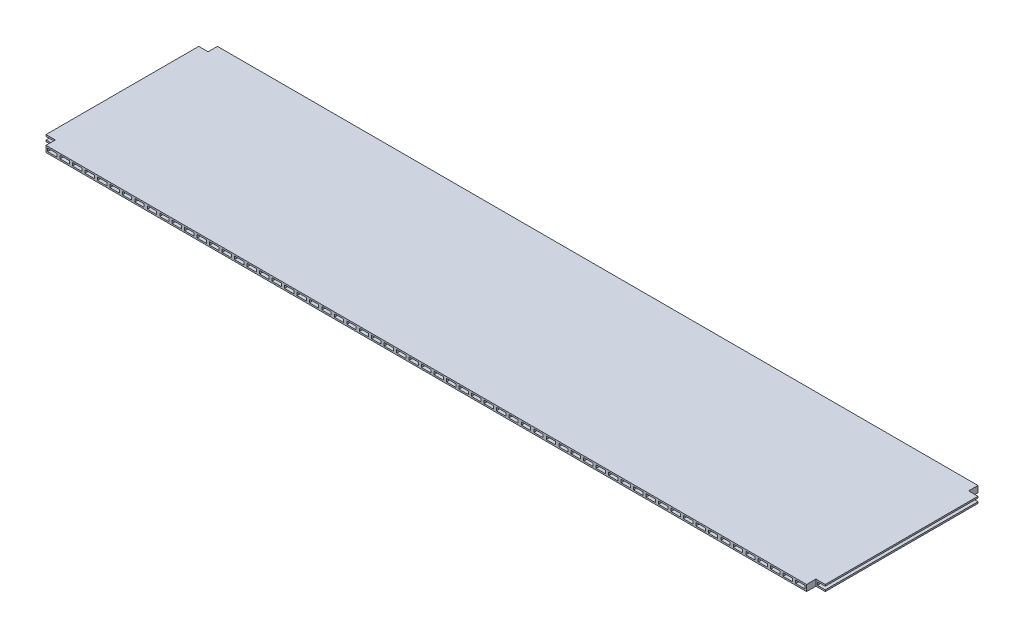
from build123d import *

# Parameters (mm, degrees)
SKETCH_1_W               = 500
SKETCH_1_H               = 110
EXTRUDE_1_DEPTH          = 4
CUT_EXTRUDE_1_DEPTH      = 274.159294186
CUT_EXTRUDE_1_DEPTH_BACK = 274.159294186
SKETCH_2_W               = 6
SKETCH_2_H               = 2
CUT_EXTRUDE_2_DEPTH      = 274.159294186
CUT_EXTRUDE_2_DEPTH_BACK = 274.159294186
SKETCH_3_W               = 6
SKETCH_3_H               = 6


with BuildPart() as part:
    # 草图1 → 凸台-拉伸1 (new body)
    with BuildSketch(Plane(origin=(0, 0, 0), x_dir=(1, 0, 0), z_dir=(0, 1, 0))):
        with Locations((0, 55)):
            Rectangle(SKETCH_1_W, SKETCH_1_H)
    extrude(amount=EXTRUDE_1_DEPTH)

    # 草图2 → 切除-拉伸1 (cut, two sides: drawn at the far end of the back side and taken through both)
    with BuildSketch(Plane(origin=(0, 0, -110), x_dir=(-1, 0, 0), z_dir=(0, 0, -1)).offset(-CUT_EXTRUDE_1_DEPTH_BACK)):
        with Locations((-56, 2)):
            Rectangle(SKETCH_2_W, SKETCH_2_H)
        with Locations((0, 2)):
            Rectangle(SKETCH_2_W, SKETCH_2_H)
        with Locations((8, 2)):
            Rectangle(SKETCH_2_W, SKETCH_2_H)
        with Locations((16, 2)):
            Rectangle(SKETCH_2_W, SKETCH_2_H)
        with Locations((24, 2)):
            Rectangle(SKETCH_2_W, SKETCH_2_H)
        with Locations((32, 2)):
            Rectangle(SKETCH_2_W, SKETCH_2_H)
        with Locations((40, 2)):
            Rectangle(SKETCH_2_W, SKETCH_2_H)
        with Locations((48, 2)):
            Rectangle(SKETCH_2_W, SKETCH_2_H)
        with Locations((-8, 2)):
            Rectangle(SKETCH_2_W, SKETCH_2_H)
        with Locations((-16, 2)):
            Rectangle(SKETCH_2_W, SKETCH_2_H)
        with Locations((-24, 2)):
            Rectangle(SKETCH_2_W, SKETCH_2_H)
        with Locations((-32, 2)):
            Rectangle(SKETCH_2_W, SKETCH_2_H)
        with Locations((-40, 2)):
            Rectangle(SKETCH_2_W, SKETCH_2_H)
        with Locations((-48, 2)):
            Rectangle(SKETCH_2_W, SKETCH_2_H)
        with Locations((-64, 2)):
            Rectangle(SKETCH_2_W, SKETCH_2_H)
        with Locations((-72, 2)):
            Rectangle(SKETCH_2_W, SKETCH_2_H)
        with Locations((-80, 2)):
            Rectangle(SKETCH_2_W, SKETCH_2_H)
        with Locations((-88, 2)):
            Rectangle(SKETCH_2_W, SKETCH_2_H)
        with Locations((-96, 2)):
            Rectangle(SKETCH_2_W, SKETCH_2_H)
        with Locations((-104, 2)):
            Rectangle(SKETCH_2_W, SKETCH_2_H)
        with Locations((-112, 2)):
            Rectangle(SKETCH_2_W, SKETCH_2_H)
        with Locations((-120, 2)):
            Rectangle(SKETCH_2_W, SKETCH_2_H)
        with Locations((-128, 2)):
            Rectangle(SKETCH_2_W, SKETCH_2_H)
        with Locations((-136, 2)):
            Rectangle(SKETCH_2_W, SKETCH_2_H)
        with Locations((-144, 2)):
            Rectangle(SKETCH_2_W, SKETCH_2_H)
        with Locations((-152, 2)):
            Rectangle(SKETCH_2_W, SKETCH_2_H)
        with Locations((-160, 2)):
            Rectangle(SKETCH_2_W, SKETCH_2_H)
        with Locations((-168, 2)):
            Rectangle(SKETCH_2_W, SKETCH_2_H)
        with Locations((-176, 2)):
            Rectangle(SKETCH_2_W, SKETCH_2_H)
        with Locations((-184, 2)):
            Rectangle(SKETCH_2_W, SKETCH_2_H)
        with Locations((-192, 2)):
            Rectangle(SKETCH_2_W, SKETCH_2_H)
        with Locations((-200, 2)):
            Rectangle(SKETCH_2_W, SKETCH_2_H)
        with Locations((-208, 2)):
            Rectangle(SKETCH_2_W, SKETCH_2_H)
        with Locations((-216, 2)):
            Rectangle(SKETCH_2_W, SKETCH_2_H)
        with Locations((-224, 2)):
            Rectangle(SKETCH_2_W, SKETCH_2_H)
        with Locations((-232, 2)):
            Rectangle(SKETCH_2_W, SKETCH_2_H)
        with Locations((-240, 2)):
            Rectangle(SKETCH_2_W, SKETCH_2_H)
        with Locations((-248, 2)):
            Rectangle(SKETCH_2_W, SKETCH_2_H)
        with Locations((-256, 2)):
            Rectangle(SKETCH_2_W, SKETCH_2_H)
        with Locations((-264, 2)):
            Rectangle(SKETCH_2_W, SKETCH_2_H)
        with Locations((-272, 2)):
            Rectangle(SKETCH_2_W, SKETCH_2_H)
        with Locations((-280, 2)):
            Rectangle(SKETCH_2_W, SKETCH_2_H)
        with Locations((-288, 2)):
            Rectangle(SKETCH_2_W, SKETCH_2_H)
        with Locations((-296, 2)):
            Rectangle(SKETCH_2_W, SKETCH_2_H)
        with Locations((-304, 2)):
            Rectangle(SKETCH_2_W, SKETCH_2_H)
        with Locations((-312, 2)):
            Rectangle(SKETCH_2_W, SKETCH_2_H)
        with Locations((56, 2)):
            Rectangle(SKETCH_2_W, SKETCH_2_H)
        with Locations((64, 2)):
            Rectangle(SKETCH_2_W, SKETCH_2_H)
        with Locations((72, 2)):
            Rectangle(SKETCH_2_W, SKETCH_2_H)
        with Locations((80, 2)):
            Rectangle(SKETCH_2_W, SKETCH_2_H)
        with Locations((88, 2)):
            Rectangle(SKETCH_2_W, SKETCH_2_H)
        with Locations((96, 2)):
            Rectangle(SKETCH_2_W, SKETCH_2_H)
        with Locations((104, 2)):
            Rectangle(SKETCH_2_W, SKETCH_2_H)
        with Locations((112, 2)):
            Rectangle(SKETCH_2_W, SKETCH_2_H)
        with Locations((120, 2)):
            Rectangle(SKETCH_2_W, SKETCH_2_H)
        with Locations((128, 2)):
            Rectangle(SKETCH_2_W, SKETCH_2_H)
        with Locations((136, 2)):
            Rectangle(SKETCH_2_W, SKETCH_2_H)
        with Locations((144, 2)):
            Rectangle(SKETCH_2_W, SKETCH_2_H)
        with Locations((152, 2)):
            Rectangle(SKETCH_2_W, SKETCH_2_H)
        with Locations((160, 2)):
            Rectangle(SKETCH_2_W, SKETCH_2_H)
        with Locations((168, 2)):
            Rectangle(SKETCH_2_W, SKETCH_2_H)
        with Locations((176, 2)):
            Rectangle(SKETCH_2_W, SKETCH_2_H)
        with Locations((184, 2)):
            Rectangle(SKETCH_2_W, SKETCH_2_H)
        with Locations((192, 2)):
            Rectangle(SKETCH_2_W, SKETCH_2_H)
        with Locations((200, 2)):
            Rectangle(SKETCH_2_W, SKETCH_2_H)
        with Locations((208, 2)):
            Rectangle(SKETCH_2_W, SKETCH_2_H)
        with Locations((216, 2)):
            Rectangle(SKETCH_2_W, SKETCH_2_H)
        with Locations((224, 2)):
            Rectangle(SKETCH_2_W, SKETCH_2_H)
        with Locations((232, 2)):
            Rectangle(SKETCH_2_W, SKETCH_2_H)
        with Locations((240, 2)):
            Rectangle(SKETCH_2_W, SKETCH_2_H)
        with Locations((248, 2)):
            Rectangle(SKETCH_2_W, SKETCH_2_H)
        with Locations((256, 2)):
            Rectangle(SKETCH_2_W, SKETCH_2_H)
        with Locations((264, 2)):
            Rectangle(SKETCH_2_W, SKETCH_2_H)
        with Locations((272, 2)):
            Rectangle(SKETCH_2_W, SKETCH_2_H)
        with Locations((280, 2)):
            Rectangle(SKETCH_2_W, SKETCH_2_H)
        with Locations((288, 2)):
            Rectangle(SKETCH_2_W, SKETCH_2_H)
        with Locations((296, 2)):
            Rectangle(SKETCH_2_W, SKETCH_2_H)
        with Locations((304, 2)):
            Rectangle(SKETCH_2_W, SKETCH_2_H)
        with Locations((312, 2)):
            Rectangle(SKETCH_2_W, SKETCH_2_H)
    extrude(amount=CUT_EXTRUDE_1_DEPTH + CUT_EXTRUDE_1_DEPTH_BACK, mode=Mode.SUBTRACT)

    # 草图3 → 切除-拉伸2 (cut, two sides: drawn at the far end of the back side and taken through both)
    with BuildSketch(Plane.XZ.offset(-CUT_EXTRUDE_2_DEPTH_BACK)):
        with Locations((247, -3)):
            Rectangle(SKETCH_3_W, SKETCH_3_H)
        with Locations((247, -107)):
            Rectangle(SKETCH_3_W, SKETCH_3_H)
        with Locations((-247, -3)):
            Rectangle(SKETCH_3_W, SKETCH_3_H)
        with Locations((-247, -107)):
            Rectangle(SKETCH_3_W, SKETCH_3_H)
    extrude(amount=CUT_EXTRUDE_2_DEPTH + CUT_EXTRUDE_2_DEPTH_BACK, mode=Mode.SUBTRACT)


solid = part.part
